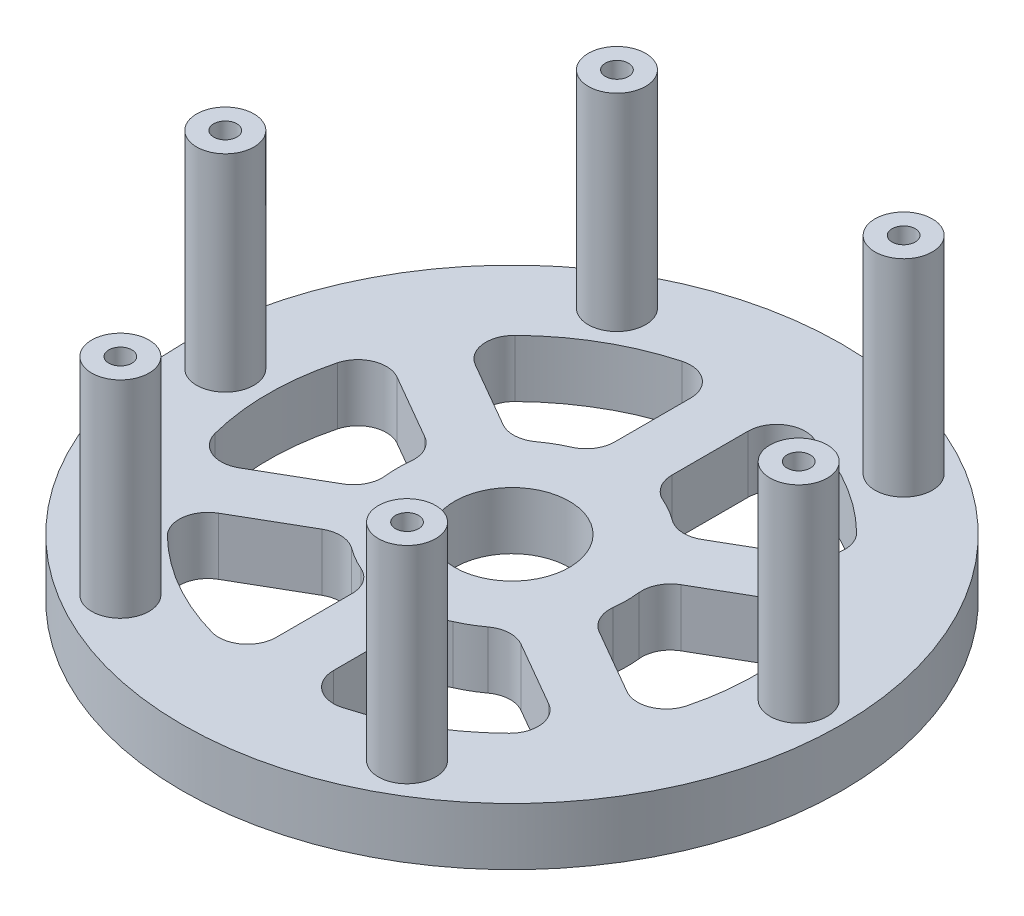
from build123d import *

# Parameters (mm, degrees)
SKETCH1_R                  = 20
SKETCH1_R_2                = 10
BOSS_EXTRUDE1_DEPTH        = 5
SKETCH1_R_3                = 57.5
SKETCH1_R_4                = 42.5
BOSS_EXTRUDE1_2_DEPTH      = 5
SKETCH2_W                  = 10
SKETCH2_H                  = 32.5
BOSS_EXTRUDE2_DEPTH        = 10
SKETCH4_R                  = 5
BOSS_EXTRUDE3_DEPTH        = 36
TAP_DRILL_FOR_10_32_TAP1_D = 4.0386
FILLET1_R                  = 5
CIRPATTERN1_COUNT          = 6
FILLET1_OF_CIRPATTERN1_R   = 5


with BuildPart() as part:
    # Sketch1 → Boss-Extrude1 (new, symmetric)
    with BuildSketch(Plane(origin=(0, 0, 0), x_dir=(1, 0, 0), z_dir=(0, 1, 0))):
        with Locations(Location((0, 0, 0), (0, 0, 270))):
            Circle(SKETCH1_R)
        with Locations(Location((0, 0, 0), (0, 0, 270))):
            Circle(SKETCH1_R_2, mode=Mode.SUBTRACT)
    extrude(amount=BOSS_EXTRUDE1_DEPTH, both=True)



with BuildPart() as body_2:
    # Sketch1 → Boss-Extrude1 2 (new, symmetric)
    with BuildSketch(Plane(origin=(0, 0, 0), x_dir=(1, 0, 0), z_dir=(0, 1, 0))):
        with Locations(Location((0, 0, 0), (0, 0, 270))):
            Circle(SKETCH1_R_3)
        with Locations(Location((0, 0, 0), (0, 0, 270))):
            Circle(SKETCH1_R_4, mode=Mode.SUBTRACT)
    extrude(amount=BOSS_EXTRUDE1_2_DEPTH, both=True)


with BuildPart() as part_1:
    add(part.part)

    add(body_2.part)  # Boss-Extrude2 merges body 2
    # Sketch2 → Boss-Extrude2 (add)
    with BuildSketch(Plane.XZ.offset(5)):
        with Locations((0, 26.25)):
            Rectangle(SKETCH2_W, SKETCH2_H)
    boss_extrude2 = extrude(amount=-BOSS_EXTRUDE2_DEPTH)

    # Sketch4 → Boss-Extrude3 (add)
    with BuildSketch(Plane(origin=(0, 5, 0), x_dir=(1, 0, 0), z_dir=(0, 1, 0))):
        with Locations(Location((50, 0, 0), (0, 0, 270))):
            Circle(SKETCH4_R)
    boss_extrude3 = extrude(amount=BOSS_EXTRUDE3_DEPTH)

    # Tap Drill for #10-32 Tap1 (through all)
    with Locations(Plane(origin=(0, -5, 0), x_dir=(-1, 0, 0), z_dir=(0, -1, 0))):
        with Locations((-50, 0)):
            tap_drill_for_10_32_tap1 = Hole(TAP_DRILL_FOR_10_32_TAP1_D / 2)

    # Fillet1
    fillet1_edges = [part_1.edges().sort_by_distance(p)[0] for p in [
        (5, 0, 19.364916731),
        (-5, 0, 19.364916731),
        (5, 0, 42.20485754),
        (-5, 0, 42.20485754),
    ]]
    fillet(fillet1_edges, radius=FILLET1_R)

    # CirPattern1: Boss-Extrude2, Boss-Extrude3, Tap Drill for #10-32 Tap1 ×6 about axis
    cirpattern1_axis = Axis((0, 0, 0), (0, 1, 0))
    add([boss_extrude2.rotate(cirpattern1_axis, i * 360 / CIRPATTERN1_COUNT) for i in range(1, CIRPATTERN1_COUNT)])
    add([boss_extrude3.rotate(cirpattern1_axis, i * 360 / CIRPATTERN1_COUNT) for i in range(1, CIRPATTERN1_COUNT)])
    add([tap_drill_for_10_32_tap1.rotate(cirpattern1_axis, i * 360 / CIRPATTERN1_COUNT) for i in range(1, CIRPATTERN1_COUNT)], mode=Mode.SUBTRACT)

    # Fillet1 of CirPattern1
    fillet1_of_cirpattern1_edges = [part_1.edges().sort_by_distance(p)[0] for p in [
        (19.270509831, 0, 5.352331347),
        (14.270509831, 0, 14.012585384),
        (39.050478793, 0, 16.772301751),
        (34.050478793, 0, 25.432555789),
        (14.270509831, 0, -14.012585384),
        (19.270509831, 0, -5.352331347),
        (34.050478793, 0, -25.432555789),
        (39.050478793, 0, -16.772301751),
        (-5, 0, -19.364916731),
        (5, 0, -19.364916731),
        (-5, 0, -42.20485754),
        (5, 0, -42.20485754),
        (-19.270509831, 0, -5.352331347),
        (-14.270509831, 0, -14.012585384),
        (-39.050478793, 0, -16.772301751),
        (-34.050478793, 0, -25.432555789),
        (-14.270509831, 0, 14.012585384),
        (-19.270509831, 0, 5.352331347),
        (-34.050478793, 0, 25.432555789),
        (-39.050478793, 0, 16.772301751),
    ]]
    fillet(fillet1_of_cirpattern1_edges, radius=FILLET1_OF_CIRPATTERN1_R)


solid = part_1.part
